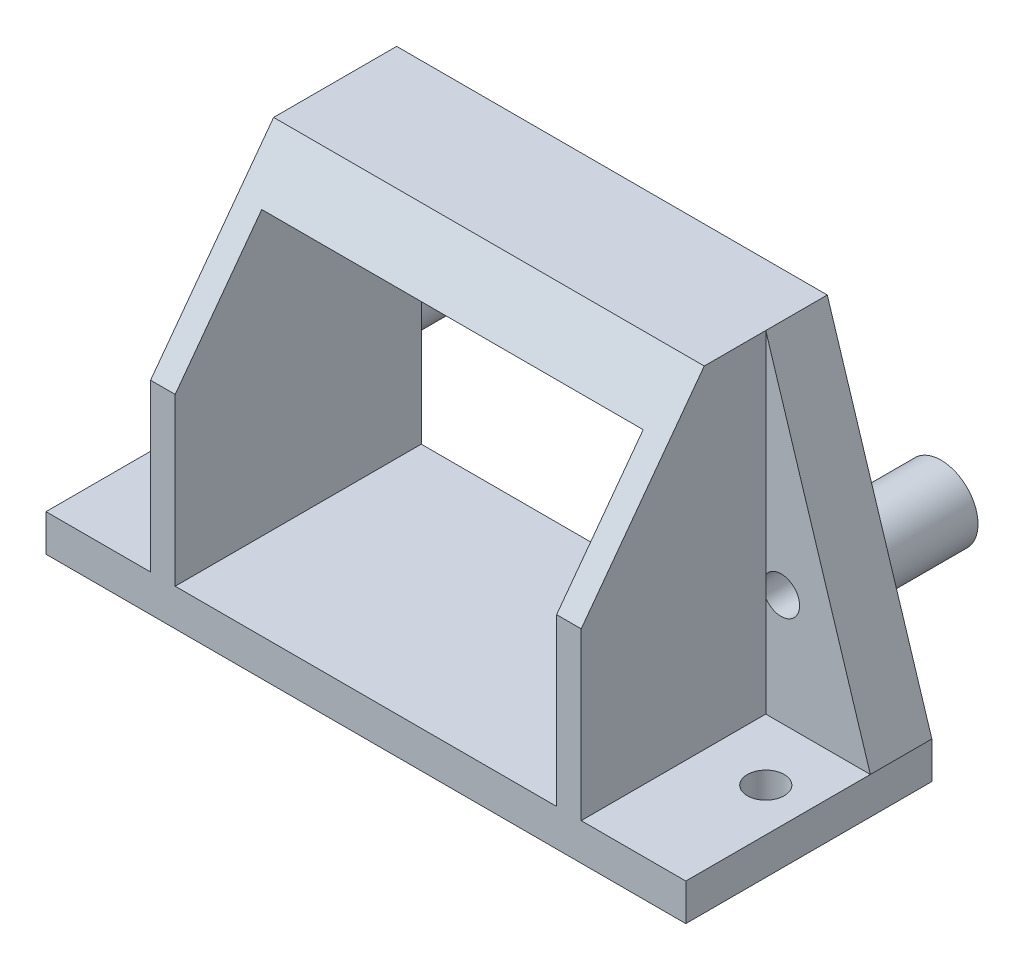
from build123d import *
from build123d.topology import SkipClean

# Parameters (mm, degrees)
SKETCH_1_W          = 31
SKETCH_1_H          = 23
EXTRUDE_1_DEPTH     = 20
CUT_EXTRUDE_1_DEPTH = 46
CUT_EXTRUDE_2_DEPTH = 15
SKETCH_4_R          = 1.5
CUT_EXTRUDE_3_DEPTH = 15
SKETCH_5_R          = 1.5
CUT_EXTRUDE_4_DEPTH = 10
SKETCH_6_R          = 3
SKETCH_6_R_2        = 1.5
EXTRUDE_2_DEPTH     = 8


with BuildPart() as part:
    # 草图1 → 凸台-拉伸1 (new body)
    with BuildSketch(Plane.XY):
        Polygon((-26, 0), (26, 0), (26, 3), (17.5, 30), (-17.5, 30), (-26, 3), align=None)
        with Locations((0, 14.5)):
            Rectangle(SKETCH_1_W, SKETCH_1_H, mode=Mode.SUBTRACT)
    extrude(amount=EXTRUDE_1_DEPTH)

    # 草图2 → 切除-拉伸1 (cut, symmetric)
    with BuildSketch(Plane(origin=(-15.5, 0, 0), x_dir=(0, 0, -1), z_dir=(1, 0, 0))):
        Polygon((-20, 16.5), (-10, 30), (-20, 30), align=None)
    extrude(amount=CUT_EXTRUDE_1_DEPTH, both=True, mode=Mode.SUBTRACT)

    # 草图3 → 切除-拉伸2 (cut)
    with BuildSketch(Plane.XY.offset(20)):
        Polygon((17.5, 30), (17.5, 3), (26, 3), align=None)
        Polygon((-17.5, 30), (-26, 3), (-17.5, 3), align=None)
    extrude(amount=-CUT_EXTRUDE_2_DEPTH, mode=Mode.SUBTRACT)

    # 草图4 → 切除-拉伸3 (cut)
    with BuildSketch(Plane.XZ):
        with Locations(Location((-22.5, 10, 0), (0, 0, 270))):
            Circle(SKETCH_4_R)
        with Locations(Location((22.5, 10, 0), (0, 0, 270))):
            Circle(SKETCH_4_R)
    extrude(amount=-CUT_EXTRUDE_3_DEPTH, mode=Mode.SUBTRACT)

    # 草图5 → 切除-拉伸4 (cut)
    with BuildSketch(Plane.XY.offset(5)):
        with Locations((-18.75, 12)):
            Circle(SKETCH_5_R)
        with Locations((18.75, 12)):
            Circle(SKETCH_5_R)
    extrude(amount=-CUT_EXTRUDE_4_DEPTH, mode=Mode.SUBTRACT)

    # 草图6 → 凸台-拉伸2 (add)
    # profile 1 of 2: a face of its own
    with SkipClean():  # the faces are left unmerged after this step: merging them gives an invalid solid
        with BuildSketch(Plane(origin=(0, 0, 0), x_dir=(-1, 0, 0), z_dir=(0, 0, -1))):
            with Locations(Location((18.75, 12, 0), (0, 0, 180))):
                Circle(SKETCH_6_R)
            with Locations(Location((18.75, 12, 0), (0, 0, 146.442690238))):
                Circle(SKETCH_6_R_2, mode=Mode.SUBTRACT)
        # profile 2 of 2: a face of its own
        with BuildSketch(Plane(origin=(0, 0, 0), x_dir=(-1, 0, 0), z_dir=(0, 0, -1))):
            with Locations(Location((-18.75, 12, 0), (0, 0, 180))):
                Circle(SKETCH_6_R)
            with Locations(Location((-18.75, 12, 0), (0, 0, 33.557309762))):
                Circle(SKETCH_6_R_2, mode=Mode.SUBTRACT)
        extrude(amount=EXTRUDE_2_DEPTH)


solid = part.part
